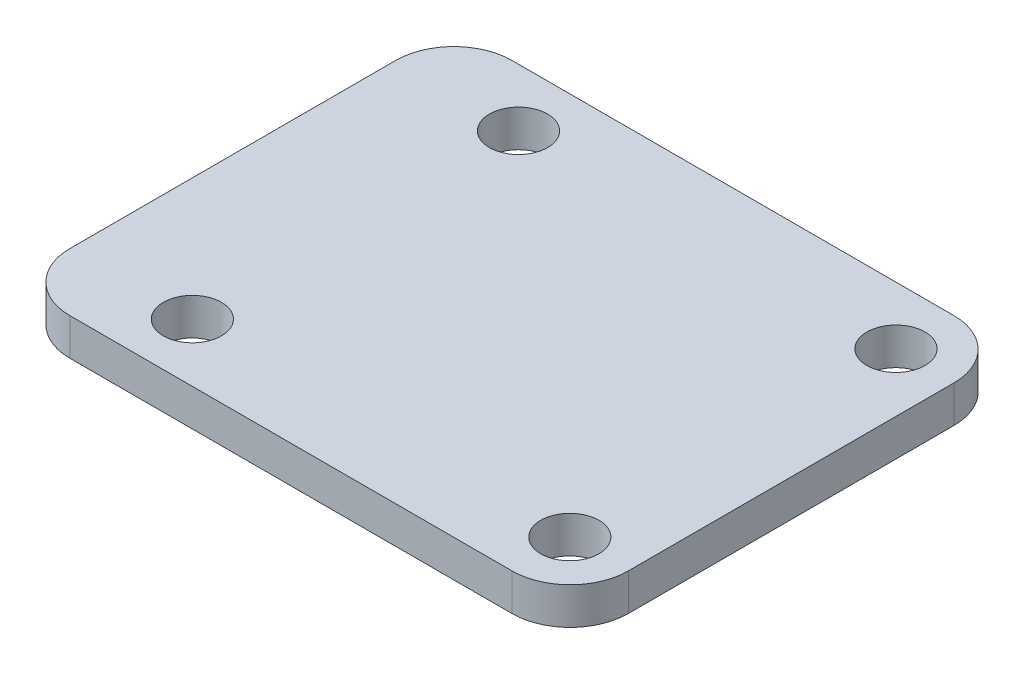
from build123d import *

# Parameters (mm, degrees)
SKETCH1_W           = 24
SKETCH1_H           = 19
BOSS_EXTRUDE1_DEPTH = 1.5875
FILLET1_R           = 2.5
SKETCH2_R           = 1.25
CUT_EXTRUDE1_DEPTH  = 16.38733753


with BuildPart() as part:
    # Sketch1 → Boss-Extrude1 (new body)
    with BuildSketch(Plane(origin=(0, 0, 0), x_dir=(1, 0, 0), z_dir=(0, 1, 0))):
        Rectangle(SKETCH1_W, SKETCH1_H)
    extrude(amount=BOSS_EXTRUDE1_DEPTH)

    # Fillet1
    fillet1_edges = [part.edges().sort_by_distance(p)[0] for p in [
        (12, 0.79375, 9.5),
        (-12, 0.79375, 9.5),
        (-12, 0.79375, -9.5),
        (12, 0.79375, -9.5),
    ]]
    fillet(fillet1_edges, radius=FILLET1_R)

    # Sketch2 → Cut-Extrude1 (cut, through all)
    with BuildSketch(Plane(origin=(0, 1.5875, 0), x_dir=(1, 0, 0), z_dir=(0, 1, 0))):
        with Locations(Location((-6.74188989, 7.020781019, 0), (0, 0, 270))):
            Circle(SKETCH2_R)
        with Locations(Location((9.482298371, 7.020781019, 0), (0, 0, 270))):
            Circle(SKETCH2_R)
        with Locations(Location((9.482298371, -6.996529616, 0), (0, 0, 270))):
            Circle(SKETCH2_R)
        with Locations(Location((-6.74188989, -6.996529616, 0), (0, 0, 270))):
            Circle(SKETCH2_R)
    extrude(amount=-CUT_EXTRUDE1_DEPTH, mode=Mode.SUBTRACT)


solid = part.part
